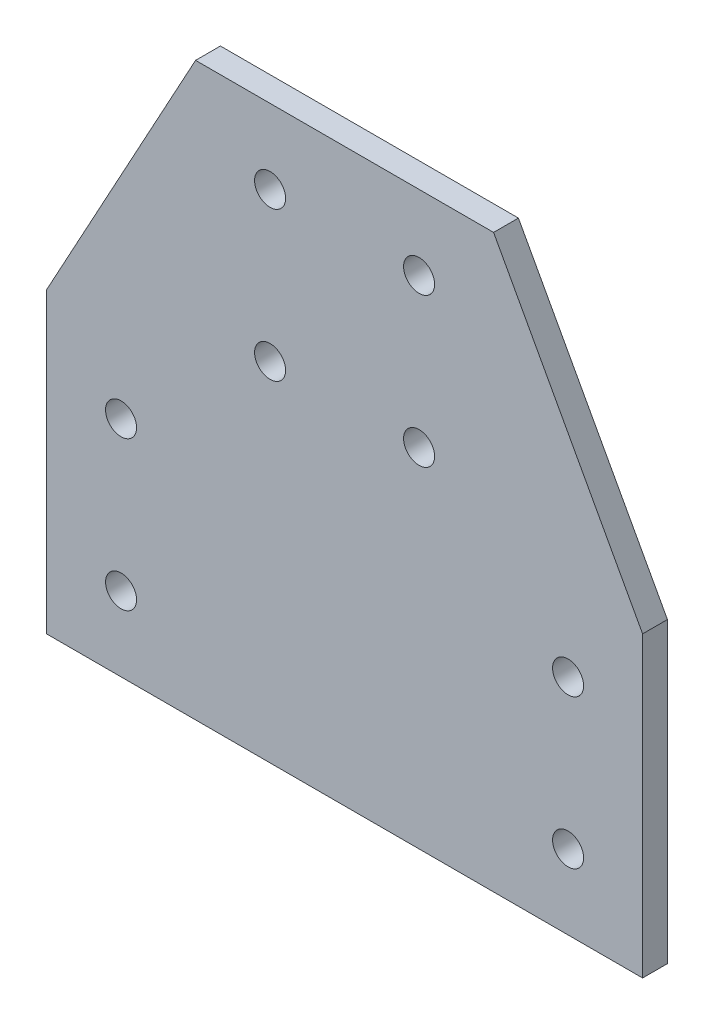
from build123d import *

# Parameters (mm, degrees)
SKETCH1_W                      = 38.1
SKETCH1_H                      = 38.1
SKETCH1_W_2                    = 114.3
BOSS_EXTRUDE1_DEPTH            = 6.35
F_5_16_0_3125_DIAMETER_HOLE1_D = 7.9375


with BuildPart() as part:
    # Sketch1 → Boss-Extrude1 (new body)
    # profile 1 of 3: a face of its own
    with BuildSketch(Plane.XY):
        Polygon((152.4, 0), (0, 0), (0, 76.2), (38.1, 146.05), (114.3, 146.05), (152.4, 76.2), align=None)
        with Locations((76.2, 107.95)):
            Rectangle(SKETCH1_W, SKETCH1_H, mode=Mode.SUBTRACT)
        with Locations((76.2, 38.1)):
            Rectangle(SKETCH1_W_2, SKETCH1_H, mode=Mode.SUBTRACT)
    # profile 2 of 3: a face of its own
    with BuildSketch(Plane.XY):
        with Locations((76.2, 107.95)):
            Rectangle(SKETCH1_W, SKETCH1_H)
    # profile 3 of 3: a face of its own
    with BuildSketch(Plane.XY):
        with Locations((76.2, 38.1)):
            Rectangle(SKETCH1_W_2, SKETCH1_H)
    extrude(amount=BOSS_EXTRUDE1_DEPTH)

    # 5/16 (0.3125) Diameter Hole1 (through all)
    with Locations(Plane.XY.offset(6.35)):
        with Locations((19.05, 19.05), (19.05, 57.15), (57.15, 88.9), (57.15, 127), (95.25, 127), (95.25, 88.9), (133.35, 57.15), (133.35, 19.05)):
            Hole(F_5_16_0_3125_DIAMETER_HOLE1_D / 2)


solid = part.part
